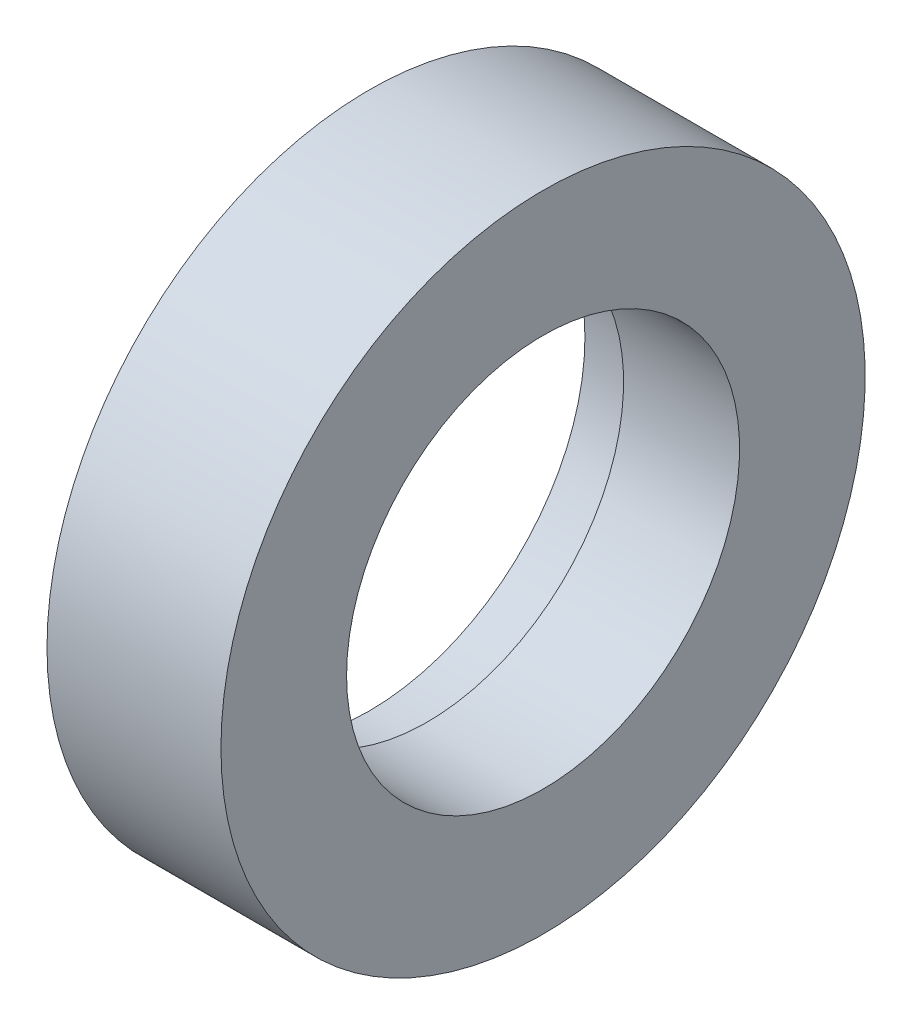
from build123d import *


with BuildPart() as part:
    # Sketch1 → Revolve1 (revolve)
    with BuildSketch(Plane.XY, mode=Mode.PRIVATE) as revolve1_sk:
        Polygon((0, 33.5), (9, 33.5), (9, 30.5), (27, 30.5), (27, 50), (0, 50), align=None)
    revolve(revolve1_sk.sketch.rotate(Axis((0, 0, 0), (1, 0, 0)), 90), axis=Axis((0, 0, 0), (1, 0, 0)))


solid = part.part
